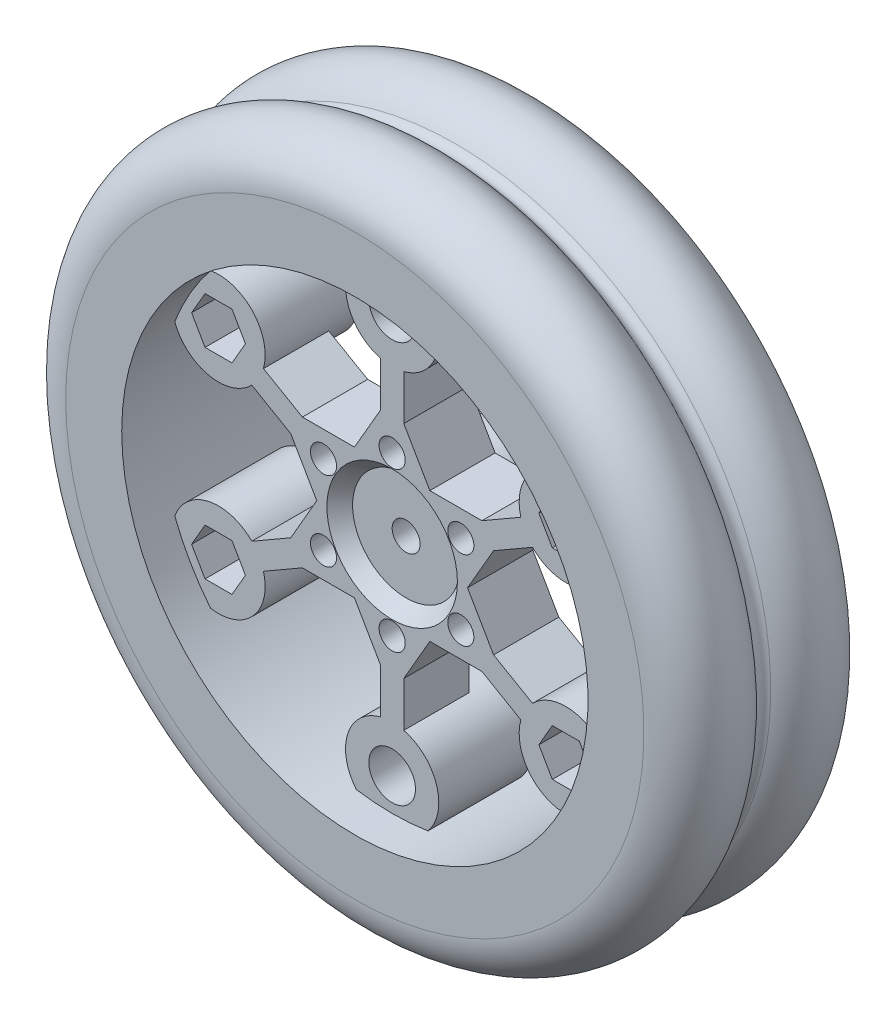
from build123d import *

# Parameters (mm, degrees)
SKETCH_2_R               = 5
EXTRUDE_1_DEPTH          = 10
PATTERN_CIRCULAR_1_COUNT = 6
EXTRUDE_2_DEPTH          = 7
SKETCH_4_R               = 1.4
CUT_EXTRUDE_1_DEPTH      = 53.086466711
PATTERN_CIRCULAR_2_COUNT = 6
SKETCH_5_R               = 5.5
EXTRUDE_3_DEPTH          = 5
SKETCH_7_R               = 7
CUT_EXTRUDE_3_DEPTH      = 1.5
CUT_EXTRUDE_3_DRAFT      = -40
SKETCH_8_R               = 1.5
CUT_EXTRUDE_4_DEPTH      = 53.93628259
SKETCH_10_R              = 1.25
CUT_EXTRUDE_6_DEPTH      = 54.366656391
PATTERN_CIRCULAR_3_COUNT = 6
SKETCH_11_R              = 2.5
CUT_EXTRUDE_7_DEPTH      = 54.366656391
PATTERN_CIRCULAR_4_COUNT = 2
CUT_EXTRUDE_8_DEPTH      = 8
PATTERN_CIRCULAR_5_COUNT = 6
CUT_EXTRUDE_9_DEPTH      = 8


with BuildPart() as part:
    # 草图1 → 旋转1 (revolve)
    with BuildSketch(Plane(origin=(0, 0, 0), x_dir=(1, 0, 0), z_dir=(0, 1, 0)), mode=Mode.PRIVATE) as revolve_1_sk:
        with BuildLine():
            Line((25, 10), (25, -10))
            Line((25, -10), (31, -10))
            ThreePointArc((31, -10), (35.787135539, -6.443375673), (33.763853992, -0.833333333))
            ThreePointArc((33.763853992, -0.833333333), (33.31662479, 0), (33.763853992, 0.833333333))
            ThreePointArc((33.763853992, 0.833333333), (35.787135539, 6.443375673), (31, 10))
            Line((31, 10), (25, 10))
        make_face()
    revolve(revolve_1_sk.sketch.rotate(Axis((0, 0, -146.934042126), (0, 0, 1)), 180), axis=Axis((0, 0, -146.934042126), (0, 0, 1)))

    # 草图2 → 凸台-拉伸1 (add)
    with BuildSketch(Plane.XY.offset(6)):
        with Locations((0, 21.5)):
            Circle(SKETCH_2_R)
    extrude_1 = extrude(amount=-EXTRUDE_1_DEPTH)

    # 阵列(圆周)1: 凸台-拉伸1 ×6 about axis
    pattern_circular_1_axis = Axis((0, 0, 0), (0, 0, 1))
    for i in range(1, PATTERN_CIRCULAR_1_COUNT):
        add(extrude_1.rotate(pattern_circular_1_axis, i * 360 / PATTERN_CIRCULAR_1_COUNT))

    # 草图3 → 凸台-拉伸2 (add)
    with BuildSketch(Plane.XY.offset(6)):
        with BuildLine():
            Line((-8.082903769, 0), (-10.874355653, -4.834936491))
            Line((-10.874355653, -4.834936491), (-15.051918724, -7.246853654))
            ThreePointArc((-15.051918724, -7.246853654), (-14.289419162, -8.25), (-13.801918724, -9.411917163))
            Line((-13.801918724, -9.411917163), (-9.624355653, -7))
            Line((-9.624355653, -7), (-4.041451884, -7))
            Line((-4.041451884, -7), (-1.25, -11.834936491))
            Line((-1.25, -11.834936491), (-1.25, -16.658770817))
            ThreePointArc((-1.25, -16.658770817), (0, -16.5), (1.25, -16.658770817))
            Line((1.25, -16.658770817), (1.25, -11.834936491))
            Line((1.25, -11.834936491), (4.041451884, -7))
            Line((4.041451884, -7), (9.624355653, -7))
            Line((9.624355653, -7), (13.801918724, -9.411917163))
            ThreePointArc((13.801918724, -9.411917163), (14.289419162, -8.25), (15.051918724, -7.246853654))
            Line((15.051918724, -7.246853654), (10.874355653, -4.834936491))
            Line((10.874355653, -4.834936491), (8.082903769, 0))
            Line((8.082903769, 0), (10.874355653, 4.834936491))
            Line((10.874355653, 4.834936491), (15.051918724, 7.246853654))
            ThreePointArc((15.051918724, 7.246853654), (14.289419162, 8.25), (13.801918724, 9.411917163))
            Line((13.801918724, 9.411917163), (9.624355653, 7))
            Line((9.624355653, 7), (4.041451884, 7))
            Line((4.041451884, 7), (1.25, 11.834936491))
            Line((1.25, 11.834936491), (1.25, 16.658770817))
            ThreePointArc((1.25, 16.658770817), (0, 16.5), (-1.25, 16.658770817))
            Line((-1.25, 16.658770817), (-1.25, 11.834936491))
            Line((-1.25, 11.834936491), (-4.041451884, 7))
            Line((-4.041451884, 7), (-9.624355653, 7))
            Line((-9.624355653, 7), (-13.801918724, 9.411917163))
            ThreePointArc((-13.801918724, 9.411917163), (-14.289419162, 8.25), (-15.051918724, 7.246853654))
            Line((-15.051918724, 7.246853654), (-10.874355653, 4.834936491))
            Line((-10.874355653, 4.834936491), (-8.082903769, 0))
        make_face()
    extrude(amount=-EXTRUDE_2_DEPTH)

    # 草图4 → 切除-拉伸1 (cut, through all)
    with BuildSketch(Plane(origin=(0, 0, -1), x_dir=(-1, 0, 0), z_dir=(0, 0, -1))):
        with Locations((0, 8.5)):
            Circle(SKETCH_4_R)
    cut_extrude_1 = extrude(amount=-CUT_EXTRUDE_1_DEPTH, mode=Mode.SUBTRACT)

    # 阵列(圆周)2: 切除-拉伸1 ×6 about axis
    pattern_circular_2_axis = Axis((0, 0, 0), (0, 0, 1))
    for i in range(1, PATTERN_CIRCULAR_2_COUNT):
        add(cut_extrude_1.rotate(pattern_circular_2_axis, i * 360 / PATTERN_CIRCULAR_2_COUNT), mode=Mode.SUBTRACT)

    # 草图5 → 凸台-拉伸3 (add)
    with BuildSketch(Plane(origin=(0, 0, -1), x_dir=(-1, 0, 0), z_dir=(0, 0, -1))):
        with Locations(Location((0, 0, 0), (0, 0, 180))):
            Circle(SKETCH_5_R)
    extrude(amount=EXTRUDE_3_DEPTH)


with BuildPart() as cut_extrude_3_tool:
    # 草图7 → 切除-拉伸3 (with draft: the straight prism first)
    with BuildSketch(Plane.XY.offset(6)):
        Circle(SKETCH_7_R)
    extrude(amount=-CUT_EXTRUDE_3_DEPTH)
    # 切除-拉伸3: the draft: its side faces are tilted about the plane it starts from
    cut_extrude_3_sides = [cut_extrude_3_tool.faces().sort_by_distance(p)[0] for p in [
        (-7, 0, 5.25),
    ]]
    draft(cut_extrude_3_sides, Plane.XY.offset(6), CUT_EXTRUDE_3_DRAFT)


with BuildPart() as part_1:
    add(part.part)

    # 切除-拉伸3: cut by cut_extrude_3_tool
    add(cut_extrude_3_tool.part, mode=Mode.SUBTRACT)

    # 草图8 → 切除-拉伸4 (cut, through all)
    with BuildSketch(Plane.XY.offset(4.5)):
        Circle(SKETCH_8_R)
    extrude(amount=-CUT_EXTRUDE_4_DEPTH, mode=Mode.SUBTRACT)

    # 草图10 → 切除-拉伸6 (cut, through all)
    with BuildSketch(Plane.XY.offset(6)):
        with Locations((0, 21.5)):
            Circle(SKETCH_10_R)
    cut_extrude_6 = extrude(amount=-CUT_EXTRUDE_6_DEPTH, mode=Mode.SUBTRACT)

    # 阵列(圆周)3: 切除-拉伸6 ×6 about axis
    pattern_circular_3_axis = Axis((0, 0, 0), (0, 0, 1))
    for i in range(1, PATTERN_CIRCULAR_3_COUNT):
        add(cut_extrude_6.rotate(pattern_circular_3_axis, i * 360 / PATTERN_CIRCULAR_3_COUNT), mode=Mode.SUBTRACT)

    # 草图11 → 切除-拉伸7 (cut, through all)
    with BuildSketch(Plane.XY.offset(6)):
        with Locations((0, 21.5)):
            Circle(SKETCH_11_R)
    cut_extrude_7 = extrude(amount=-CUT_EXTRUDE_7_DEPTH, mode=Mode.SUBTRACT)

    # 阵列(圆周)4: 切除-拉伸7 ×2 about axis
    pattern_circular_4_axis = Axis((0, 0, 0), (0, 0, 1))
    for i in range(1, PATTERN_CIRCULAR_4_COUNT):
        add(cut_extrude_7.rotate(pattern_circular_4_axis, i * 360 / PATTERN_CIRCULAR_4_COUNT), mode=Mode.SUBTRACT)

    # 草图12 → 切除-拉伸8 (cut)
    with BuildSketch(Plane.XY.offset(6)):
        Polygon((20.062921854, 8.25), (21.506297527, 10.75), (20.062921854, 13.25), (17.176170508, 13.25), (15.732794835, 10.75), (17.176170508, 8.25), align=None)
    cut_extrude_8 = extrude(amount=-CUT_EXTRUDE_8_DEPTH, mode=Mode.SUBTRACT)

    # 阵列(圆周)5: 切除-拉伸8 ×6 about axis, 2 skipped
    pattern_circular_5_axis = Axis((0, 0, 0), (0, 0, -1))
    add([cut_extrude_8.rotate(pattern_circular_5_axis, i * 360 / PATTERN_CIRCULAR_5_COUNT) for i in range(1, PATTERN_CIRCULAR_5_COUNT) if i not in (2, 5)], mode=Mode.SUBTRACT)

    # 草图9 → 切除-拉伸9 (cut)
    with BuildSketch(Plane(origin=(0, 0, -6), x_dir=(-1, 0, 0), z_dir=(0, 0, -1))):
        Polygon((3.5, 0), (1.75, 3.031088913), (-1.75, 3.031088913), (-3.5, 0), (-1.75, -3.031088913), (1.75, -3.031088913), align=None)
    extrude(amount=-CUT_EXTRUDE_9_DEPTH, mode=Mode.SUBTRACT)


solid = part_1.part
